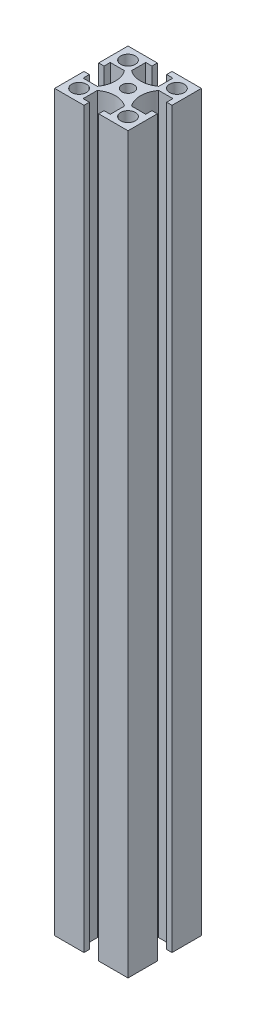
from build123d import *

# Parameters (mm, degrees)
SKETCH1_R           = 3
SKETCH1_R_2         = 2.5
BOSS_EXTRUDE1_DEPTH = 300


with BuildPart() as part:
    # Sketch1 → Boss-Extrude1 (new body)
    with BuildSketch(Plane(origin=(0, 0, 0), x_dir=(1, 0, 0), z_dir=(0, 1, 0))):
        with BuildLine():
            Line((-3, -15), (-3, -12.8))
            Line((-3, -12.8), (-5.55, -12.8))
            Line((-5.55, -12.8), (-5.55, -7))
            ThreePointArc((-5.55, -7), (0, -5.16), (5.55, -7))
            Line((5.55, -7), (5.55, -12.8))
            Line((5.55, -12.8), (3, -12.8))
            Line((3, -12.8), (3, -15))
            Line((3, -15), (15, -15))
            Line((15, -15), (15, -3))
            Line((15, -3), (12.8, -3))
            Line((12.8, -3), (12.8, -5.55))
            Line((12.8, -5.55), (7, -5.55))
            ThreePointArc((7, -5.55), (5.16, 0), (7, 5.55))
            Line((7, 5.55), (12.8, 5.55))
            Line((12.8, 5.55), (12.8, 3))
            Line((12.8, 3), (15, 3))
            Line((15, 3), (15, 15))
            Line((15, 15), (3, 15))
            Line((3, 15), (3, 12.8))
            Line((3, 12.8), (5.55, 12.8))
            Line((5.55, 12.8), (5.55, 7))
            ThreePointArc((5.55, 7), (0, 5.16), (-5.55, 7))
            Line((-5.55, 7), (-5.55, 12.8))
            Line((-5.55, 12.8), (-3, 12.8))
            Line((-3, 12.8), (-3, 15))
            Line((-3, 15), (-15, 15))
            Line((-15, 15), (-15, 3))
            Line((-15, 3), (-12.8, 3))
            Line((-12.8, 3), (-12.8, 5.55))
            Line((-12.8, 5.55), (-7, 5.55))
            ThreePointArc((-7, 5.55), (-5.16, 0), (-7, -5.55))
            Line((-7, -5.55), (-12.8, -5.55))
            Line((-12.8, -5.55), (-12.8, -3))
            Line((-12.8, -3), (-15, -3))
            Line((-15, -3), (-15, -15))
            Line((-15, -15), (-3, -15))
        make_face()
        with Locations(Location((-10, 10, 0), (0, 0, 270))):
            Circle(SKETCH1_R, mode=Mode.SUBTRACT)
        with Locations(Location((10, 10, 0), (0, 0, 270))):
            Circle(SKETCH1_R, mode=Mode.SUBTRACT)
        with Locations(Location((-10, -10, 0), (0, 0, 270))):
            Circle(SKETCH1_R, mode=Mode.SUBTRACT)
        with Locations(Location((10, -10, 0), (0, 0, 270))):
            Circle(SKETCH1_R, mode=Mode.SUBTRACT)
        with Locations(Location((0, 0, 0), (0, 0, 270))):
            Circle(SKETCH1_R_2, mode=Mode.SUBTRACT)
    extrude(amount=BOSS_EXTRUDE1_DEPTH)


solid = part.part
